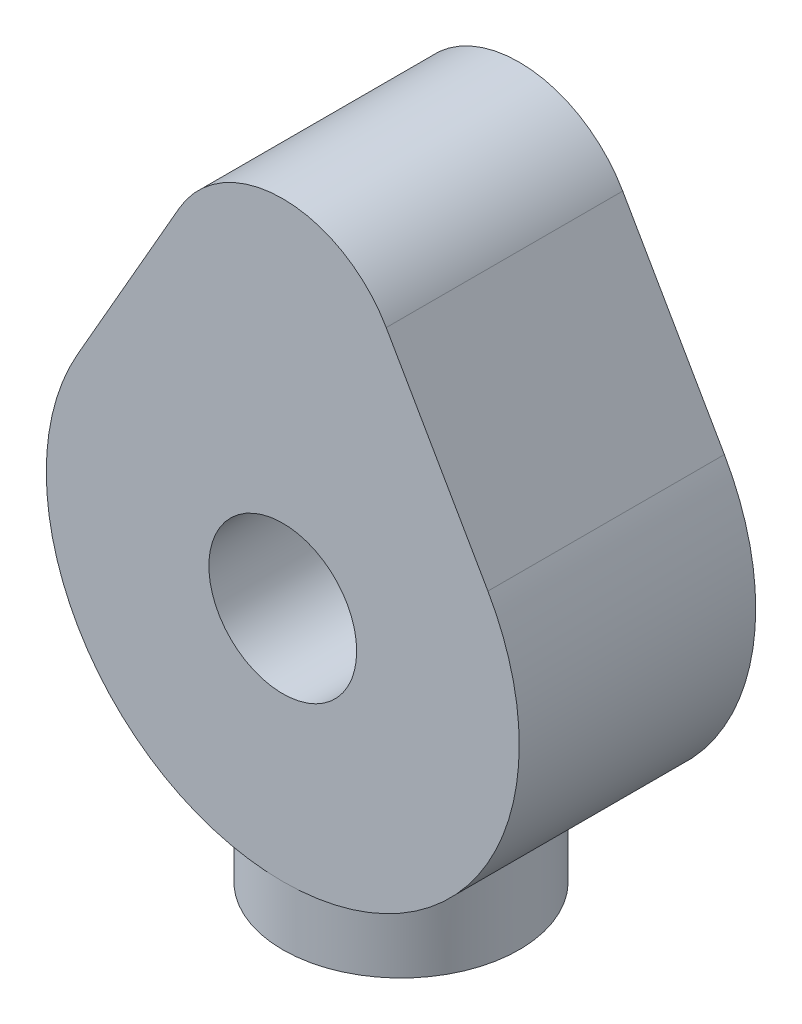
from build123d import *

# Parameters (mm, degrees)
BOSS_EXTRU_1_DEPTH      = 20
ESQUISSE2_R             = 20
BOSS_EXTRU_2_DEPTH      = 50
ESQUISSE3_R             = 12.5
ENL_V_MAT_EXTRU_1_DEPTH = 83.487366196


with BuildPart() as part:
    # Esquisse1 → Boss.-Extru.1 (new, symmetric)
    with BuildSketch(Plane.XY):
        with BuildLine():
            Line((-17.5, 49.896071292), (-34.700811909, 19.896071292))
            ThreePointArc((-34.700811909, 19.896071292), (0, -40), (34.700811909, 19.896071292))
            Line((34.700811909, 19.896071292), (17.5, 49.896071292))
            ThreePointArc((17.5, 49.896071292), (0, 60.034703013), (-17.5, 49.896071292))
        make_face()
    extrude(amount=BOSS_EXTRU_1_DEPTH, both=True)

    # Esquisse2 → Boss.-Extru.2 (add)
    with BuildSketch(Plane(origin=(0, 0, 0), x_dir=(1, 0, 0), z_dir=(0, 1, 0))):
        with Locations(Location((0, 0, 0), (0, 0, 270))):
            Circle(ESQUISSE2_R)
    extrude(amount=-BOSS_EXTRU_2_DEPTH)

    # Esquisse3 → Enlèv. mat.-Extru.1 (cut, through all)
    with BuildSketch(Plane.XY.offset(20)):
        Circle(ESQUISSE3_R)
    extrude(amount=-ENL_V_MAT_EXTRU_1_DEPTH, mode=Mode.SUBTRACT)

    # Esquisse5 → Enlèvement de matière-Révolution1 (revolve, cut)
    with BuildSketch(Plane.XY, mode=Mode.PRIVATE) as enl_vement_de_mati_re_r_volution1_sk:
        Polygon((0, -50), (0, -20), (10, -25.773502692), (10, -50), align=None)
    revolve(enl_vement_de_mati_re_r_volution1_sk.sketch.rotate(Axis((0, -50, 0), (0, 1, 0)), 90), axis=Axis((0, -50, 0), (0, 1, 0)), mode=Mode.SUBTRACT)


solid = part.part
